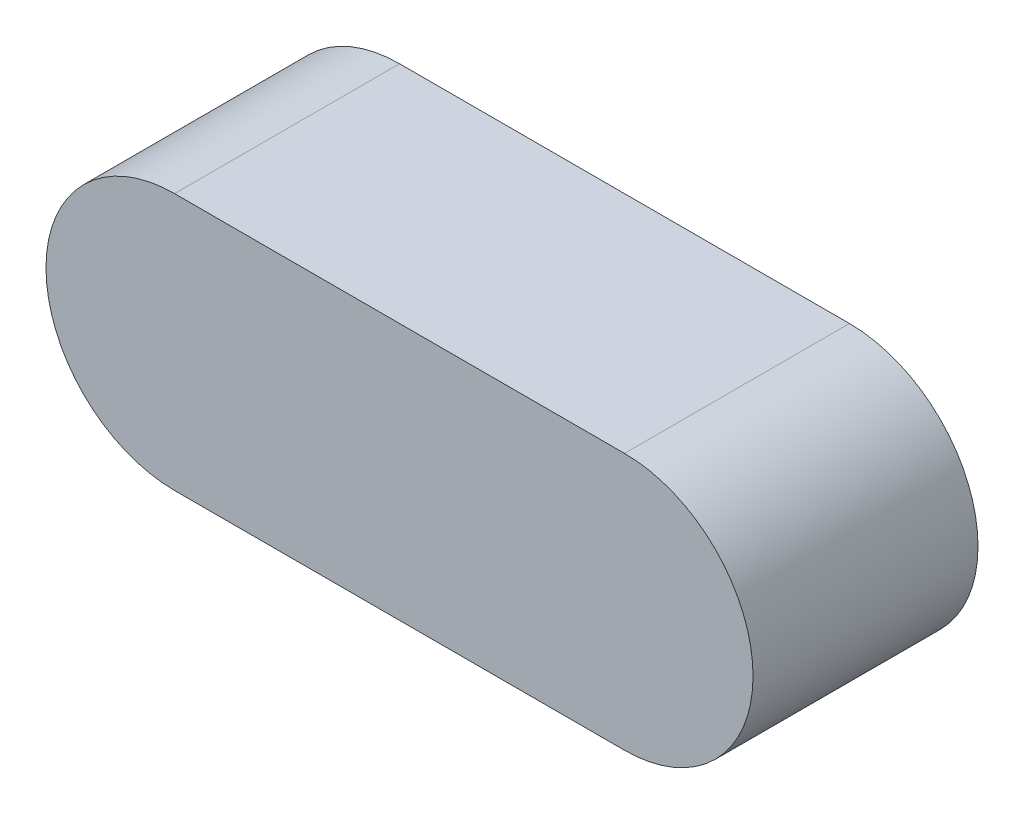
from build123d import *

# Parameters (mm, degrees)
ESTRUSIONE_ESTRUSIONE1_DEPTH = 7


with BuildPart() as part:
    # Schizzo1 → Estrusione-Estrusione1 (new body)
    with BuildSketch(Plane.XY):
        with BuildLine():
            Line((0, 4), (14, 4))
            ThreePointArc((14, 4), (18, 0), (14, -4))
            Line((14, -4), (0, -4))
            ThreePointArc((0, -4), (-4, 0), (0, 4))
        make_face()
    extrude(amount=ESTRUSIONE_ESTRUSIONE1_DEPTH)


solid = part.part
